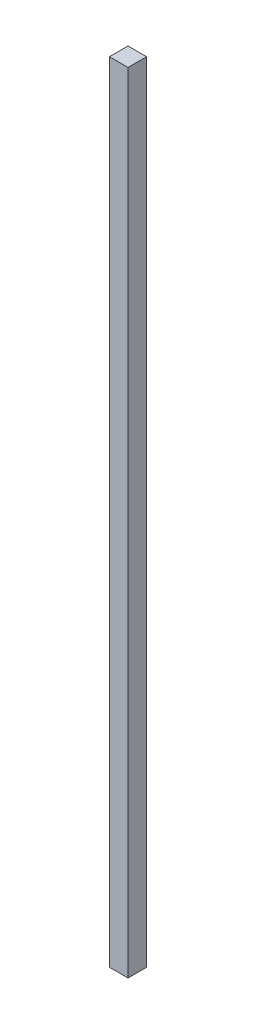
from build123d import *

# Parameters (mm, degrees)
PACK_KAPAK_KOLU_DIKEY_1_1_START = -596
SKETCH1_W                       = 8
SKETCH1_H                       = 340
PACK_KAPAK_KOLU_DIKEY_1_1_DEPTH = 8


with BuildPart() as part:
    # Sketch1 → PACK_kapak_kolu_dikey_1_1 (new body)
    with BuildSketch(Plane.XY.offset(PACK_KAPAK_KOLU_DIKEY_1_1_START)):
        with Locations((130, 810)):
            Rectangle(SKETCH1_W, SKETCH1_H)
    extrude(amount=-PACK_KAPAK_KOLU_DIKEY_1_1_DEPTH)


solid = part.part
